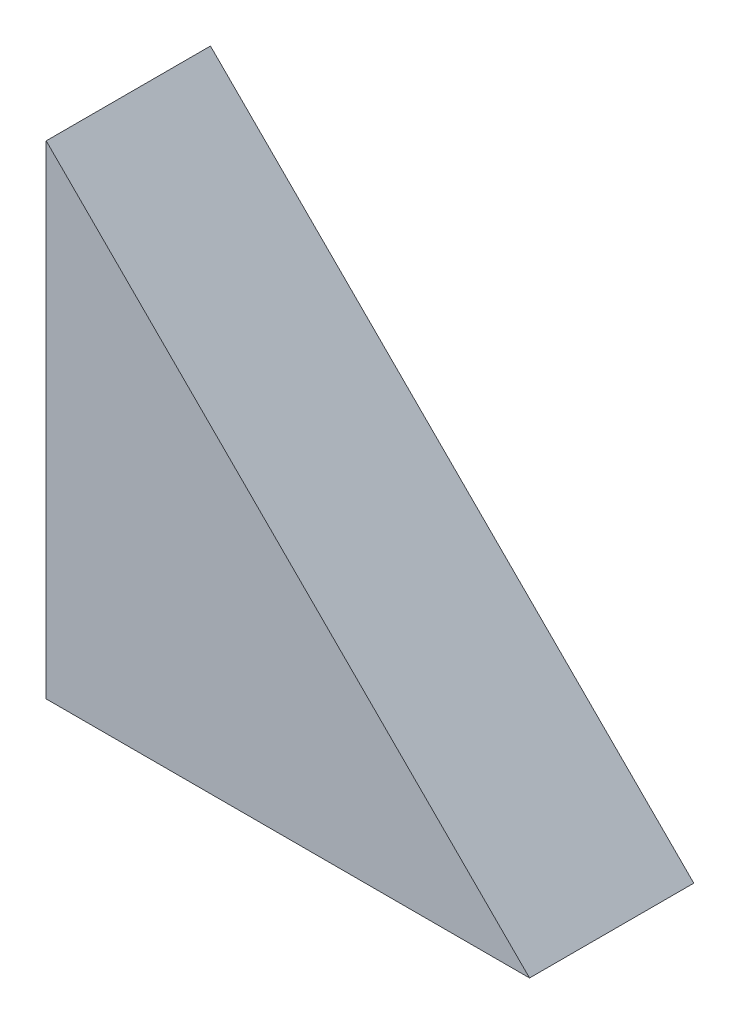
from build123d import *

# Parameters (mm, degrees)
BOSS_EXTRUDE1_DEPTH = 35


with BuildPart() as part:
    # Sketch3 → Boss-Extrude1 (new body)
    with BuildSketch(Plane.XY):
        Polygon((0, 0), (103, 0), (0, 103), align=None)
    extrude(amount=BOSS_EXTRUDE1_DEPTH)


solid = part.part
